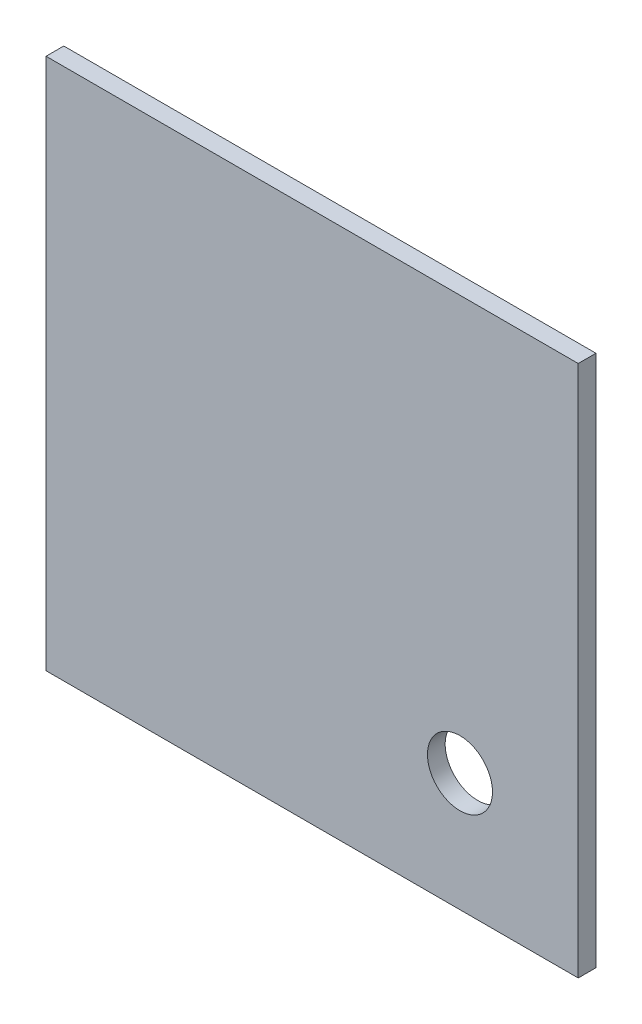
from build123d import *

# Parameters (mm, degrees)
SKETCH1_W           = 90
SKETCH1_H           = 90
SKETCH1_R           = 5.5
BOSS_EXTRUDE1_DEPTH = 3


with BuildPart() as part:
    # Sketch1 → Boss-Extrude1 (new body)
    with BuildSketch(Plane.XY):
        Rectangle(SKETCH1_W, SKETCH1_H)
        with Locations((25, -25)):
            Circle(SKETCH1_R, mode=Mode.SUBTRACT)
    extrude(amount=BOSS_EXTRUDE1_DEPTH)


solid = part.part
